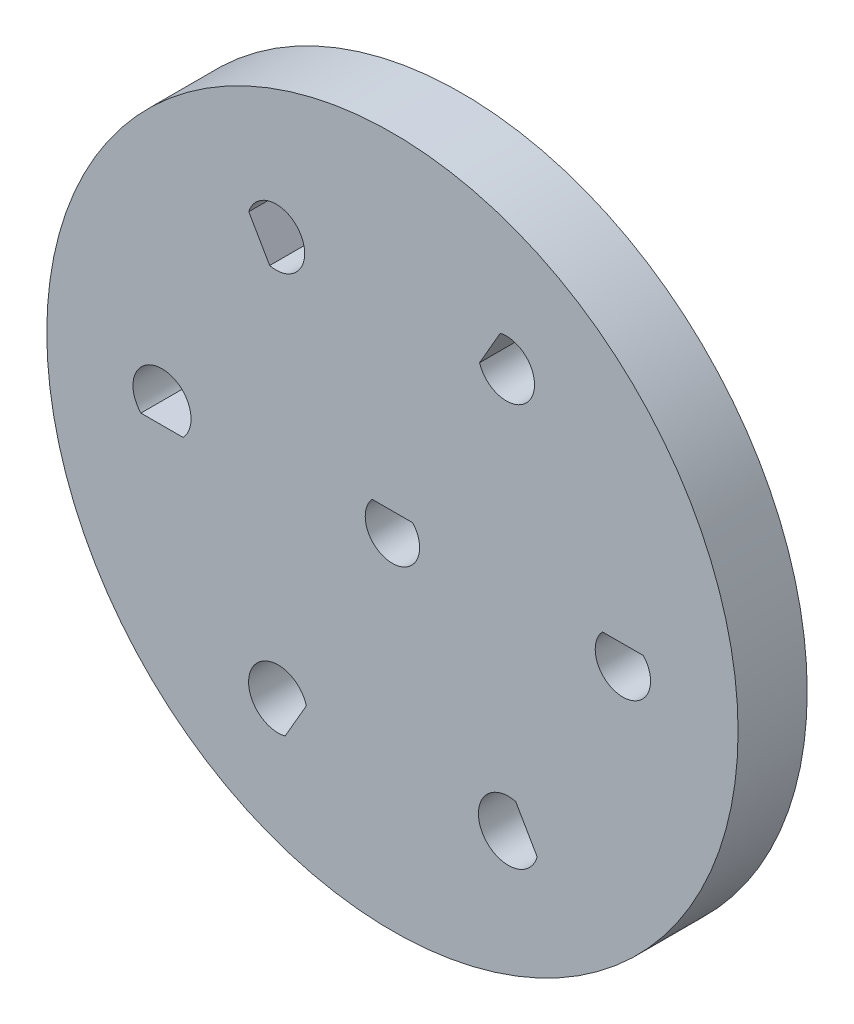
from build123d import *

# Parameters (mm, degrees)
SKETCH1_R           = 19.05
BOSS_EXTRUDE1_DEPTH = 3.81


with BuildPart() as part:
    # Sketch1 → Boss-Extrude1 (new body)
    with BuildSketch(Plane.XY):
        with Locations(Location((0, 0, 0), (0, 0, 180))):
            Circle(SKETCH1_R)
        with BuildLine():
            Line((1.118033989, 1), (-1.118033989, 1))
            ThreePointArc((-1.118033989, 1), (0, -1.5), (1.118033989, 1))
        make_face(mode=Mode.SUBTRACT)
        with BuildLine():
            Line((13.829158979, 1.016666667), (11.570841021, 1.016666667))
            ThreePointArc((11.570841021, 1.016666667), (12.7, -1.533333333), (13.829158979, 1.016666667))
        make_face(mode=Mode.SUBTRACT)
        with BuildLine():
            Line((5.942864327, 12.455213271), (4.802688902, 10.480371506))
            ThreePointArc((4.802688902, 10.480371506), (7.624442664, 10.167792388), (5.942864327, 12.455213271))
        make_face(mode=Mode.SUBTRACT)
        with BuildLine():
            Line((-7.917318674, 11.327860481), (-6.76623223, 9.334120277))
            ThreePointArc((-6.76623223, 9.334120277), (-5.046808132, 11.655990379), (-7.917318674, 11.327860481))
        make_face(mode=Mode.SUBTRACT)
        with BuildLine():
            Line((-13.861895004, -1.256937352), (-11.538104996, -1.256937352))
            ThreePointArc((-11.538104996, -1.256937352), (-12.7, 1.443062648), (-13.861895004, -1.256937352))
        make_face(mode=Mode.SUBTRACT)
        with BuildLine():
            Line((-5.915422385, -12.698362956), (-4.742818445, -10.667353355))
            ThreePointArc((-4.742818445, -10.667353355), (-7.710690276, -10.307858156), (-5.915422385, -12.698362956))
        make_face(mode=Mode.SUBTRACT)
        with BuildLine():
            Line((7.977039629, -11.520341387), (6.793823672, -9.470951234))
            ThreePointArc((6.793823672, -9.470951234), (4.96056052, -11.89564631), (7.977039629, -11.520341387))
        make_face(mode=Mode.SUBTRACT)
    extrude(amount=BOSS_EXTRUDE1_DEPTH)


solid = part.part
